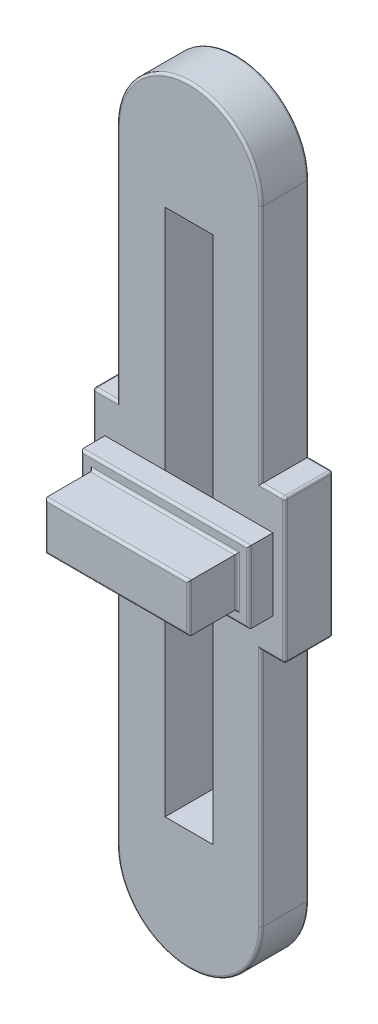
from build123d import *

# Parameters (mm, degrees)
SKETCH2_W           = 20
SKETCH2_H           = 220
BOSS_EXTRUDE1_DEPTH = 20
SKETCH3_W           = 60
SKETCH3_H           = 20
BOSS_EXTRUDE2_DEPTH = 30
SKETCH4_W           = 70
SKETCH4_H           = 30
SKETCH4_W_2         = 60
SKETCH4_H_2         = 20
BOSS_EXTRUDE3_DEPTH = 10
FILLET1_R           = 1
FILLET2_R           = 1
FILLET3_R           = 1


with BuildPart() as part:
    # Sketch2 → Boss-Extrude1 (new body)
    with BuildSketch(Plane.XY):
        with BuildLine():
            Line((30, 0), (30, -100))
            Line((30, -100), (40, -100))
            Line((40, -100), (40, -160))
            Line((40, -160), (30, -160))
            Line((30, -160), (30, -260))
            ThreePointArc((30, -260), (0, -290), (-30, -260))
            Line((-30, -260), (-30, -160))
            Line((-30, -160), (-40, -160))
            Line((-40, -160), (-40, -100))
            Line((-40, -100), (-30, -100))
            Line((-30, -100), (-30, 0))
            ThreePointArc((-30, 0), (0, 30), (30, 0))
        make_face()
        with Locations((0, -130)):
            Rectangle(SKETCH2_W, SKETCH2_H, mode=Mode.SUBTRACT)
    extrude(amount=BOSS_EXTRUDE1_DEPTH)

    # Sketch3 → Boss-Extrude2 (add)
    with BuildSketch(Plane.XY.offset(20)):
        with Locations((0, -130)):
            Rectangle(SKETCH3_W, SKETCH3_H)
    extrude(amount=BOSS_EXTRUDE2_DEPTH)

    # Sketch4 → Boss-Extrude3 (add)
    with BuildSketch(Plane.XY.offset(20)):
        with Locations((0, -130)):
            Rectangle(SKETCH4_W, SKETCH4_H)
        with Locations((0, -130)):
            Rectangle(SKETCH4_W_2, SKETCH4_H_2, mode=Mode.SUBTRACT)
    extrude(amount=BOSS_EXTRUDE3_DEPTH)

    # Fillet1
    fillet1_edges = [part.edges().sort_by_distance(p)[0] for p in [
        (30, -130, 50),
        (0, -120, 50),
        (-30, -130, 50),
        (0, -140, 50),
        (35, -130, 30),
        (0, -115, 30),
        (-35, -130, 30),
        (0, -145, 30),
        (0, -140, 30),
        (30, -130, 30),
        (0, -120, 30),
        (-30, -130, 30),
    ]]
    fillet(fillet1_edges, radius=FILLET1_R)

    # Fillet2
    fillet2_edges = [part.edges().sort_by_distance(p)[0] for p in [
        (30, -50, 0),
        (40, -130, 0),
        (30, -210, 0),
        (0, -290, 0),
        (-30, -210, 0),
        (-40, -130, 0),
        (-30, -50, 0),
        (0, 30, 0),
        (-40, -130, 20),
        (-30, -210, 20),
        (0, -290, 20),
        (30, -210, 20),
        (40, -130, 20),
        (30, -50, 20),
        (0, 30, 20),
        (-30, -50, 20),
    ]]
    fillet(fillet2_edges, radius=FILLET2_R)

    # Fillet3
    fillet3_edges = [part.edges().sort_by_distance(p)[0] for p in [
        (-34, -160, 0),
        (-39.707106781, -160, 0.292893219),
        (-40, -160, 10),
        (-39.707106781, -160, 19.707106781),
        (34, -160, 0),
        (39.707106781, -160, 0.292893219),
        (40, -160, 10),
        (39.707106781, -160, 19.707106781),
        (34, -100, 0),
        (39.707106781, -100, 0.292893219),
        (40, -100, 10),
        (39.707106781, -100, 19.707106781),
        (-34, -100, 0),
        (-39.707106781, -100, 0.292893219),
        (-40, -100, 10),
        (-39.707106781, -100, 19.707106781),
        (-34, -160, 20),
        (34, -160, 20),
        (34, -100, 20),
        (-34, -100, 20),
    ]]
    fillet(fillet3_edges, radius=FILLET3_R)


solid = part.part
